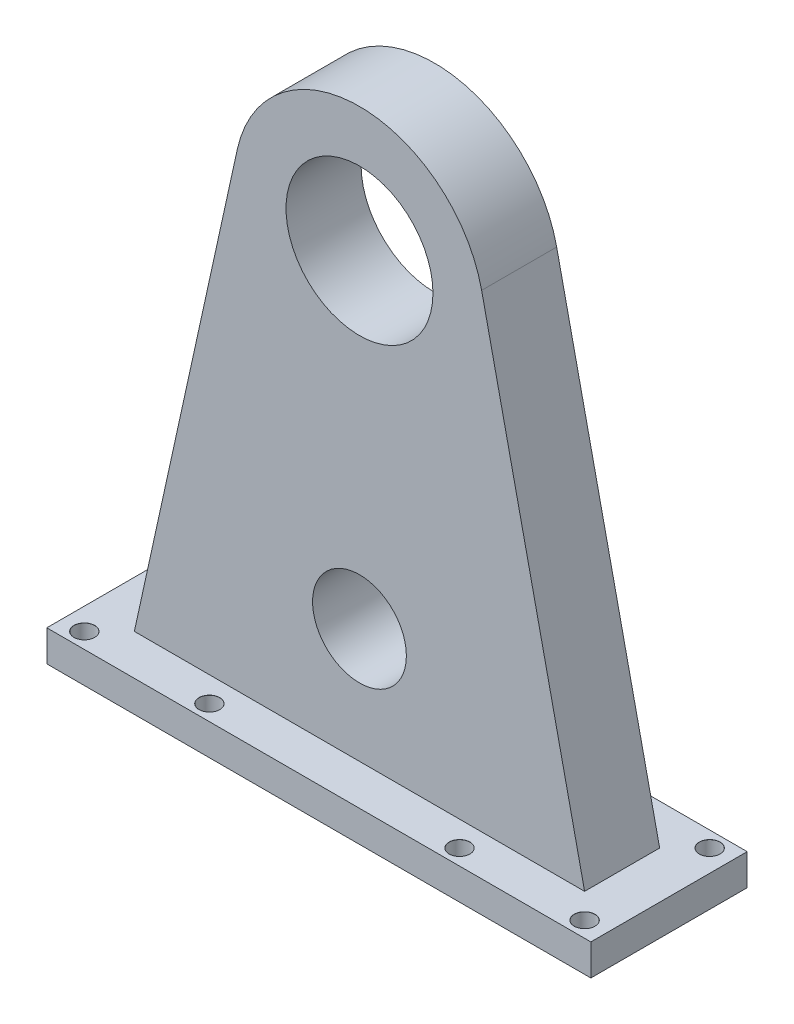
from build123d import *

# Parameters (mm, degrees)
SKETCH1_W                      = 174
SKETCH1_H                      = 50
BOSS_EXTRUDE1_DEPTH            = 10
M6_CLEARANCE_HOLE1_D           = 6.6
M6_CLEARANCE_HOLE1_CSINK_D     = 6.65
M6_CLEARANCE_HOLE1_CSINK_ANGLE = 100
BOSS_EXTRUDE2_DEPTH            = 12
BOSS_EXTRUDE2_DEPTH_BACK       = 12
CUT_EXTRUDE1_REACH             = 215.496
SKETCH7_R                      = 15
SKETCH7_R_2                    = 23.5


with BuildPart() as part:
    # Sketch1 → Boss-Extrude1 (new body)
    with BuildSketch(Plane(origin=(0, 0, 0), x_dir=(1, 0, 0), z_dir=(0, 1, 0))):
        Rectangle(SKETCH1_W, SKETCH1_H)
    extrude(amount=BOSS_EXTRUDE1_DEPTH)

    # M6 Clearance Hole1 (through all)
    with Locations(Plane(origin=(0, 10, 0), x_dir=(1, 0, 0), z_dir=(0, 1, 0))):
        with Locations((-80, 20), (-40, 20), (-80, -20), (-40, -20), (40, 20), (80, 20), (40, -20), (80, -20)):
            CounterSinkHole(M6_CLEARANCE_HOLE1_D / 2, M6_CLEARANCE_HOLE1_CSINK_D / 2, counter_sink_angle=M6_CLEARANCE_HOLE1_CSINK_ANGLE)

    # Sketch6 → Boss-Extrude2 (add, two sides: drawn at the far end of the back side and taken through both)
    with BuildSketch(Plane.XY.offset(-BOSS_EXTRUDE2_DEPTH_BACK)):
        with BuildLine():
            Line((-72, 10), (72, 10))
            Line((72, 10), (39.069577731, 160))
            ThreePointArc((39.069577731, 160), (0, 191.422815383), (-39.069577731, 160))
            Line((-39.069577731, 160), (-72, 10))
        make_face()
    extrude(amount=BOSS_EXTRUDE2_DEPTH + BOSS_EXTRUDE2_DEPTH_BACK)

    # Sketch7 → Cut-Extrude1 (cut, up to next)
    with BuildSketch(Plane.XY.offset(12), mode=Mode.PRIVATE) as cut_extrude1_sk1:
        with Locations((0, 46.722815383)):
            Circle(SKETCH7_R)
    cut_extrude1_tool1 = extrude(cut_extrude1_sk1.sketch, amount=-CUT_EXTRUDE1_REACH, mode=Mode.PRIVATE) & part.part
    # Sketch7 → Cut-Extrude1 (cut, up to next)
    with BuildSketch(Plane.XY.offset(12), mode=Mode.PRIVATE) as cut_extrude1_sk2:
        with Locations((0, 151.422815383)):
            Circle(SKETCH7_R_2)
    cut_extrude1_tool2 = extrude(cut_extrude1_sk2.sketch, amount=-CUT_EXTRUDE1_REACH, mode=Mode.PRIVATE) & part.part
    add(cut_extrude1_tool1.solids().sort_by_distance((0, 46.722815, 12))[0], mode=Mode.SUBTRACT)
    add(cut_extrude1_tool2.solids().sort_by_distance((0, 151.422815, 12))[0], mode=Mode.SUBTRACT)


solid = part.part
